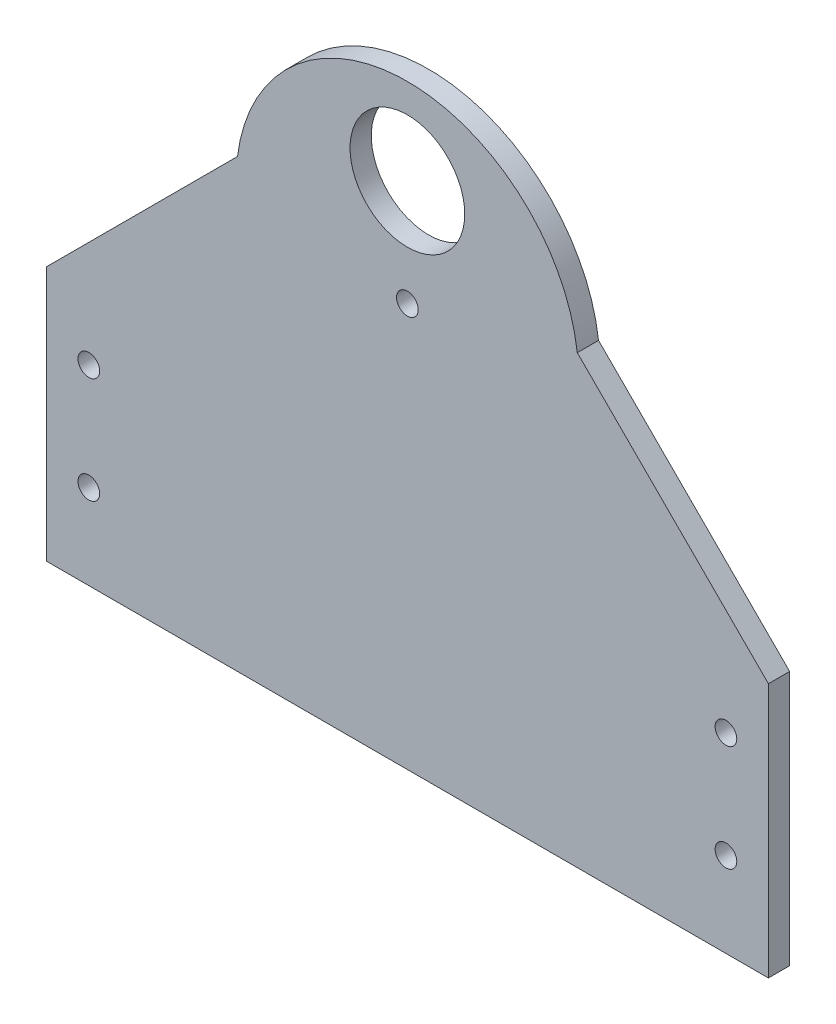
from build123d import *

# Parameters (mm, degrees)
SKETCH_1_R      = 2.55
SKETCH_1_R_2    = 13.5
EXTRUDE_1_DEPTH = 5


with BuildPart() as part:
    # ｽｹｯﾁ1 → ﾎﾞｽ - 押し出し1 (new body)
    with BuildSketch(Plane.XY):
        with BuildLine():
            Line((-85, -71.4), (-85, -11.4))
            Line((-85, -11.4), (-40, 33.6))
            ThreePointArc((-40, 33.6), (0, 68.911288741), (40, 33.6))
            Line((40, 33.6), (85, -11.4))
            Line((85, -11.4), (85, -71.4))
            Line((85, -71.4), (-85, -71.4))
        make_face()
        with Locations((75, -26.4)):
            Circle(SKETCH_1_R, mode=Mode.SUBTRACT)
        with Locations((75, -51.4)):
            Circle(SKETCH_1_R, mode=Mode.SUBTRACT)
        with Locations((-75, -26.4)):
            Circle(SKETCH_1_R, mode=Mode.SUBTRACT)
        with Locations((-75, -51.4)):
            Circle(SKETCH_1_R, mode=Mode.SUBTRACT)
        with Locations((0, 23.6)):
            Circle(SKETCH_1_R, mode=Mode.SUBTRACT)
        with Locations((0, 48.6)):
            Circle(SKETCH_1_R_2, mode=Mode.SUBTRACT)
    extrude(amount=EXTRUDE_1_DEPTH)


solid = part.part
